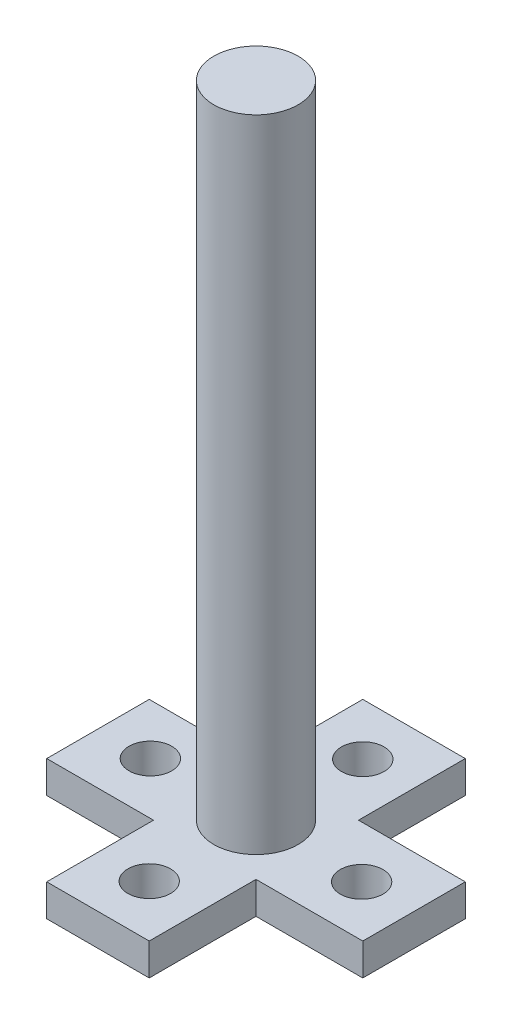
from build123d import *

# Parameters (mm, degrees)
SKETCH_1_W          = 10
SKETCH_1_H          = 9.6
SKETCH_1_R          = 2
SKETCH_1_W_2        = 9.6
SKETCH_1_H_2        = 10
SKETCH_1_R_2        = 4
EXTRUDE_2_DEPTH     = 3
SKETCH_2_R          = 3.95
EXTRUDE_3_DEPTH     = 120
CUT_EXTRUDE_START   = -60
SKETCH_3_R          = 3.95
CUT_EXTRUDE_1_DEPTH = 60


with BuildPart() as part:
    # 草图1 → 凸台-拉伸2 (new body)
    # profile 1 of 6: a face of its own
    with BuildSketch(Plane(origin=(0, 0, 0), x_dir=(1, 0, 0), z_dir=(0, 1, 0))):
        with Locations((-9.8, 0)):
            Rectangle(SKETCH_1_W, SKETCH_1_H)
        with Locations(Location((-9.946440474, 0.053559526, 0), (0, 0, 270))):
            Circle(SKETCH_1_R, mode=Mode.SUBTRACT)
    # profile 2 of 6: a face of its own
    with BuildSketch(Plane(origin=(0, 0, 0), x_dir=(1, 0, 0), z_dir=(0, 1, 0))):
        with Locations((0, -9.8)):
            Rectangle(SKETCH_1_W_2, SKETCH_1_H_2)
        with Locations(Location((-0.053559526, -9.946440474, 0), (0, 0, 270))):
            Circle(SKETCH_1_R, mode=Mode.SUBTRACT)
    # profile 3 of 6: a face of its own
    with BuildSketch(Plane(origin=(0, 0, 0), x_dir=(1, 0, 0), z_dir=(0, 1, 0))):
        Rectangle(SKETCH_1_W_2, SKETCH_1_H)
        Circle(SKETCH_1_R_2, mode=Mode.SUBTRACT)
    # profile 4 of 6: a face of its own
    with BuildSketch(Plane(origin=(0, 0, 0), x_dir=(1, 0, 0), z_dir=(0, 1, 0))):
        with Locations((9.8, 0)):
            Rectangle(SKETCH_1_W, SKETCH_1_H)
        with Locations(Location((9.946440474, -0.053559526, 0), (0, 0, 270))):
            Circle(SKETCH_1_R, mode=Mode.SUBTRACT)
    # profile 5 of 6: a face of its own
    with BuildSketch(Plane(origin=(0, 0, 0), x_dir=(1, 0, 0), z_dir=(0, 1, 0))):
        with Locations((0, 9.8)):
            Rectangle(SKETCH_1_W_2, SKETCH_1_H_2)
        with Locations(Location((0.053559526, 9.946440474, 0), (0, 0, 270))):
            Circle(SKETCH_1_R, mode=Mode.SUBTRACT)
    # profile 6 of 6: a face of its own
    with BuildSketch(Plane(origin=(0, 0, 0), x_dir=(1, 0, 0), z_dir=(0, 1, 0))):
        Circle(SKETCH_1_R_2)
    extrude(amount=EXTRUDE_2_DEPTH)

    # 草图2 → 凸台-拉伸3 (add)
    with BuildSketch(Plane(origin=(0, 3, 0), x_dir=(1, 0, 0), z_dir=(0, 1, 0))):
        with Locations(Location((0, 0, 0), (0, 0, 270))):
            Circle(SKETCH_2_R)
    extrude(amount=EXTRUDE_3_DEPTH)

    # 草图3 → 切除-拉伸1 (cut)
    with BuildSketch(Plane(origin=(0, 123, 0), x_dir=(1, 0, 0), z_dir=(0, 1, 0)).offset(CUT_EXTRUDE_START)):
        with Locations(Location((0, 0, 0), (0, 0, 270))):
            Circle(SKETCH_3_R)
    extrude(amount=CUT_EXTRUDE_1_DEPTH, mode=Mode.SUBTRACT)


solid = part.part
